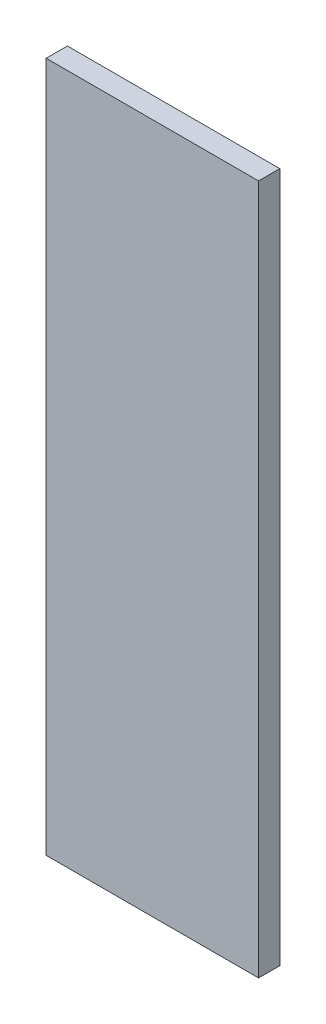
from build123d import *

# Parameters (mm, degrees)
SKETCH1_W           = 80
SKETCH1_H           = 260
BOSS_EXTRUDE1_DEPTH = 8


with BuildPart() as part:
    # Sketch1 → Boss-Extrude1 (new body)
    with BuildSketch(Plane.XY):
        Rectangle(SKETCH1_W, SKETCH1_H)
    extrude(amount=BOSS_EXTRUDE1_DEPTH)


solid = part.part
